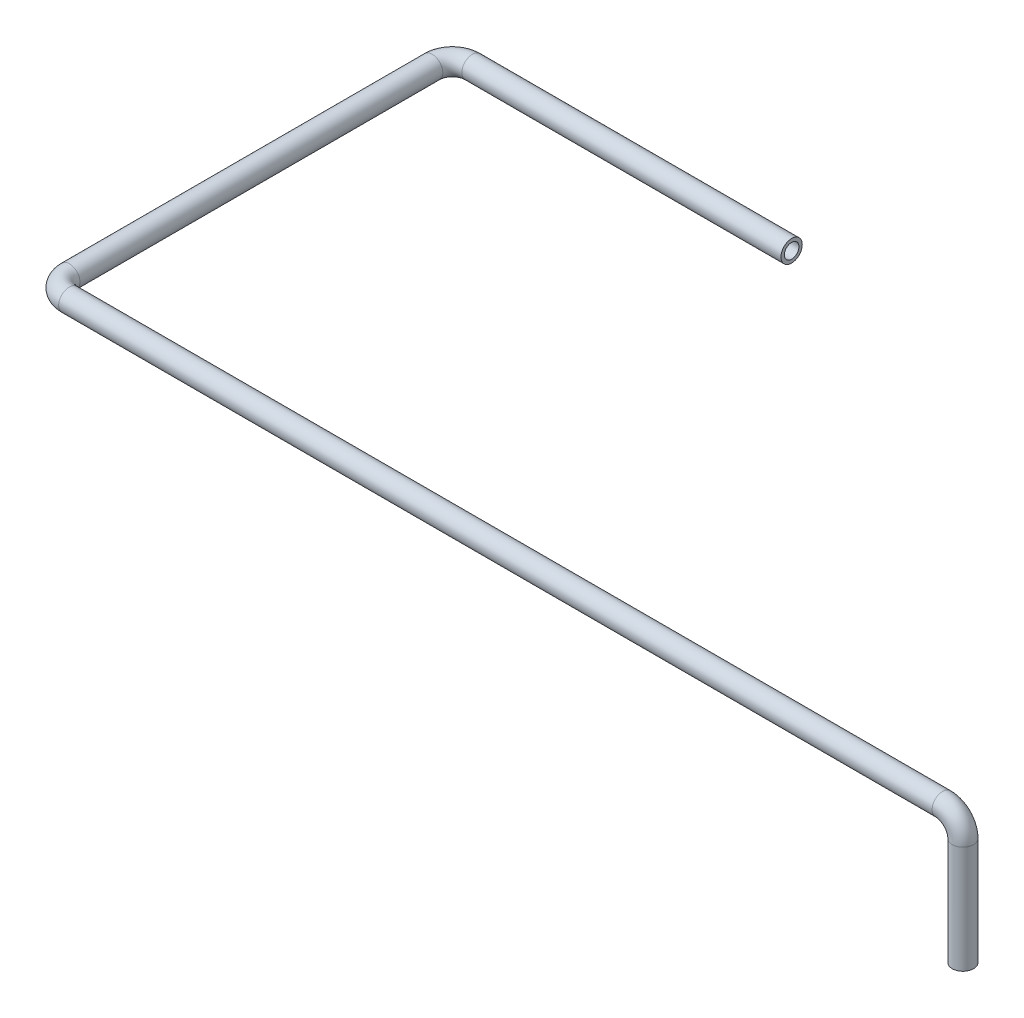
from build123d import *

# Parameters (mm, degrees)
TUBE_PROFILE_R   = 3.175
TUBE_PROFILE_R_2 = 2.175


with BuildPart() as part:
    # Tube: sweep along a curve in space
    with BuildLine() as tube_path:
        Line((11, 381, 67.5), (-84, 381, 67.5))
        ThreePointArc((-90, 381, 73.5), (-88.242640687, 381, 69.257359313), (-84, 381, 67.5))
        Line((-90, 381, 73.5), (-90, 381, 181.5))
        ThreePointArc((-84, 381, 187.5), (-88.242640687, 381, 185.742640687), (-90, 381, 181.5))
        Line((-84, 381, 187.5), (176, 381, 187.5))
        ThreePointArc((182, 375, 187.5), (180.242640687, 379.242640687, 187.5), (176, 381, 187.5))
        Line((182, 375, 187.5), (182, 343, 187.5))
    # Tube profile (on start of the path) → Tube (sweep)
    with BuildSketch(Plane(origin=(11, 381, 67.5), x_dir=(0, 0, -1), z_dir=(-1, 0, 0))):
        Circle(TUBE_PROFILE_R)
        Circle(TUBE_PROFILE_R_2, mode=Mode.SUBTRACT)
    sweep(path=tube_path.line)


solid = part.part
